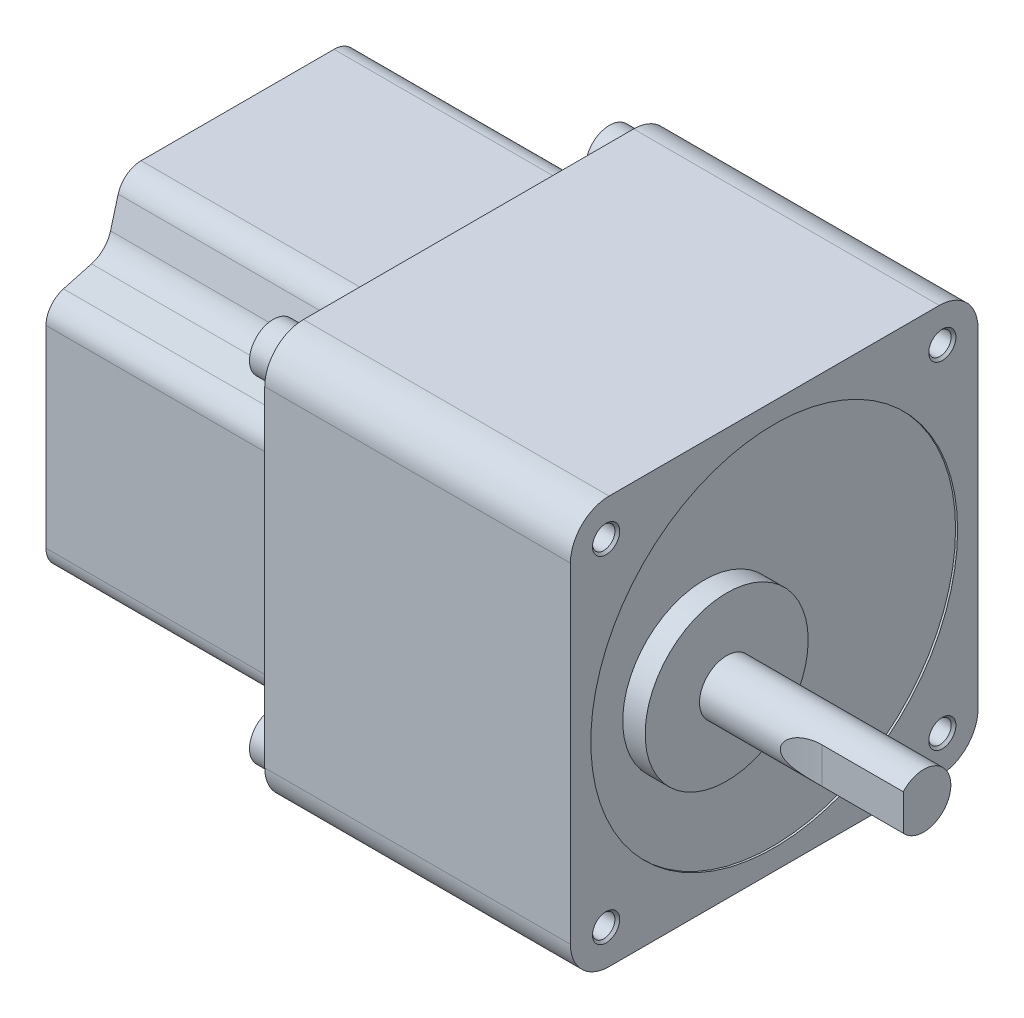
from build123d import *

# Parameters (mm, degrees)
SKETCH1_W                   = 60
SKETCH1_H                   = 60
BOSS_EXTRUDE1_DEPTH         = 45
BOSS_EXTRUDE2_DEPTH         = 34
SKETCH3_R                   = 3.5
BOSS_EXTRUDE3_DEPTH         = 4
SKETCH4_R                   = 4.5
BOSS_EXTRUDE4_DEPTH         = 1.5
SKETCH5_R                   = 0.5
BOSS_EXTRUDE5_DEPTH         = 8.5
SKETCH6_R                   = 27
CUT_EXTRUDE1_DEPTH          = 0.3
SKETCH7_R                   = 12
BOSS_EXTRUDE6_DEPTH         = 3.3
SKETCH8_R                   = 4
BOSS_EXTRUDE7_DEPTH         = 29
CUT_EXTRUDE2_DEPTH          = 109.592080743
CUT_EXTRUDE2_DEPTH_BACK     = 109.592080743
M4_TAPPED_HOLE1_D           = 3.3
M4_TAPPED_HOLE1_DEPTH       = 10.1
M4_TAPPED_HOLE1_CSINK_D     = 4
M4_TAPPED_HOLE1_CSINK_ANGLE = 90
M4_TAPPED_HOLE1_TIP         = 0.991420021
FILLET1_R                   = 3.5
FILLET2_R                   = 4
FILLET3_R                   = 5.7


with BuildPart() as part:
    # Sketch1 → Boss-Extrude1 (new body)
    with BuildSketch(Plane(origin=(0, 0, 0), x_dir=(0, 0, -1), z_dir=(1, 0, 0))):
        with Locations((30, 0)):
            Rectangle(SKETCH1_W, SKETCH1_H)
    extrude(amount=-BOSS_EXTRUDE1_DEPTH)

    # Sketch2 → Boss-Extrude2 (add)
    with BuildSketch(Plane.ZY.offset(45)):
        Polygon((-1.8, 16.87), (-1.8, -16.87), (-10.698224855, -19.301775145), (-13.13, -28.2), (-46.87, -28.2), (-49.301775145, -19.301775145), (-58.2, -16.87), (-58.2, 16.87), (-49.301775145, 19.301775145), (-46.87, 28.2), (-13.13, 28.2), (-10.698224855, 19.301775145), align=None)
    extrude(amount=BOSS_EXTRUDE2_DEPTH)

    # Sketch3 → Boss-Extrude3 (add)
    with BuildSketch(Plane.ZY.offset(45)):
        with Locations((-5.251262658, 24.748737342)):
            Circle(SKETCH3_R)
        with Locations((-5.251262658, -24.748737342)):
            Circle(SKETCH3_R)
        with Locations((-54.748737342, -24.748737342)):
            Circle(SKETCH3_R)
        with Locations((-54.748737342, 24.748737342)):
            Circle(SKETCH3_R)
    extrude(amount=BOSS_EXTRUDE3_DEPTH)

    # Sketch4 → Boss-Extrude4 (add)
    with BuildSketch(Plane(origin=(0, 0, -58.2), x_dir=(-1, 0, 0), z_dir=(0, 0, -1))):
        with Locations(Location((71, 0, 0), (0, 0, 180))):
            Circle(SKETCH4_R)
    extrude(amount=BOSS_EXTRUDE4_DEPTH)

    # Sketch5 → Boss-Extrude5 (add)
    with BuildSketch(Plane(origin=(0, 0, -59.7), x_dir=(-1, 0, 0), z_dir=(0, 0, -1))):
        with Locations((73, -2)):
            Circle(SKETCH5_R)
        with Locations((73, 0)):
            Circle(SKETCH5_R)
        with Locations((73, 2)):
            Circle(SKETCH5_R)
        with Locations((69, -2)):
            Circle(SKETCH5_R)
        with Locations((69, 0)):
            Circle(SKETCH5_R)
        with Locations((69, 2)):
            Circle(SKETCH5_R)
    extrude(amount=BOSS_EXTRUDE5_DEPTH)

    # Sketch6 → Cut-Extrude1 (cut)
    with BuildSketch(Plane(origin=(0, 0, 0), x_dir=(0, 0, -1), z_dir=(1, 0, 0))):
        with Locations((30, 0)):
            Circle(SKETCH6_R)
    extrude(amount=-CUT_EXTRUDE1_DEPTH, mode=Mode.SUBTRACT)

    # Sketch7 → Boss-Extrude6 (add)
    with BuildSketch(Plane(origin=(-0.3, 0, 0), x_dir=(0, 0, -1), z_dir=(1, 0, 0))):
        with Locations((20, 0)):
            Circle(SKETCH7_R)
    extrude(amount=BOSS_EXTRUDE6_DEPTH)

    # Sketch8 → Boss-Extrude7 (add)
    with BuildSketch(Plane(origin=(3, 0, 0), x_dir=(0, 0, -1), z_dir=(1, 0, 0))):
        with Locations(Location((20, 0, 0), (0, 0, 180))):
            Circle(SKETCH8_R)
    extrude(amount=BOSS_EXTRUDE7_DEPTH)

    # Sketch9 → Cut-Extrude2 (cut, two sides: drawn at the far end of the back side and taken through both)
    with BuildSketch(Plane(origin=(0, 0, 0), x_dir=(1, 0, 0), z_dir=(0, 1, 0)).offset(-CUT_EXTRUDE2_DEPTH_BACK)):
        with BuildLine():
            Line((32, 17), (20, 17))
            ThreePointArc((20, 17), (17.4, 16.747644855), (14.897059671, 16))
            Line((14.897059671, 16), (32, 16))
            Line((32, 16), (32, 17))
        make_face()
    extrude(amount=CUT_EXTRUDE2_DEPTH + CUT_EXTRUDE2_DEPTH_BACK, mode=Mode.SUBTRACT)

    # M4 Tapped Hole1
    with Locations(Plane(origin=(0, 0, 0), x_dir=(0, 0, -1), z_dir=(1, 0, 0))):
        with Locations((5.251262658, -24.748737342), (5.251262658, 24.748737342), (54.748737342, -24.748737342), (54.748737342, 24.748737342)):
            CounterSinkHole(M4_TAPPED_HOLE1_D / 2, M4_TAPPED_HOLE1_CSINK_D / 2, depth=M4_TAPPED_HOLE1_DEPTH, counter_sink_angle=M4_TAPPED_HOLE1_CSINK_ANGLE)
            with Locations((0, 0, -(M4_TAPPED_HOLE1_DEPTH + M4_TAPPED_HOLE1_TIP / 2))):  # 118° drill point
                Cone(0, M4_TAPPED_HOLE1_D / 2, M4_TAPPED_HOLE1_TIP, mode=Mode.SUBTRACT)

    # Fillet1
    fillet1_edges = [part.edges().sort_by_distance(p)[0] for p in [
        (-62, 16.87, -1.8),
        (-62, 28.2, -13.13),
        (-62, 28.2, -46.87),
        (-62, 16.87, -58.2),
        (-62, -16.87, -58.2),
        (-62, -28.2, -46.87),
        (-62, -28.2, -13.13),
        (-62, -16.87, -1.8),
    ]]
    fillet(fillet1_edges, radius=FILLET1_R)

    # Fillet2
    fillet2_edges = [part.edges().sort_by_distance(p)[0] for p in [
        (-62, 19.301775145, -10.698224855),
        (-62, 19.301775145, -49.301775145),
        (-62, -19.301775145, -49.301775145),
        (-62, -19.301775145, -10.698224855),
    ]]
    fillet(fillet2_edges, radius=FILLET2_R)

    # Fillet3
    fillet3_edges = [part.edges().sort_by_distance(p)[0] for p in [
        (-22.5, 30, 0),
        (-22.5, 30, -60),
        (-22.5, -30, -60),
        (-22.5, -30, 0),
    ]]
    fillet(fillet3_edges, radius=FILLET3_R)


solid = part.part
